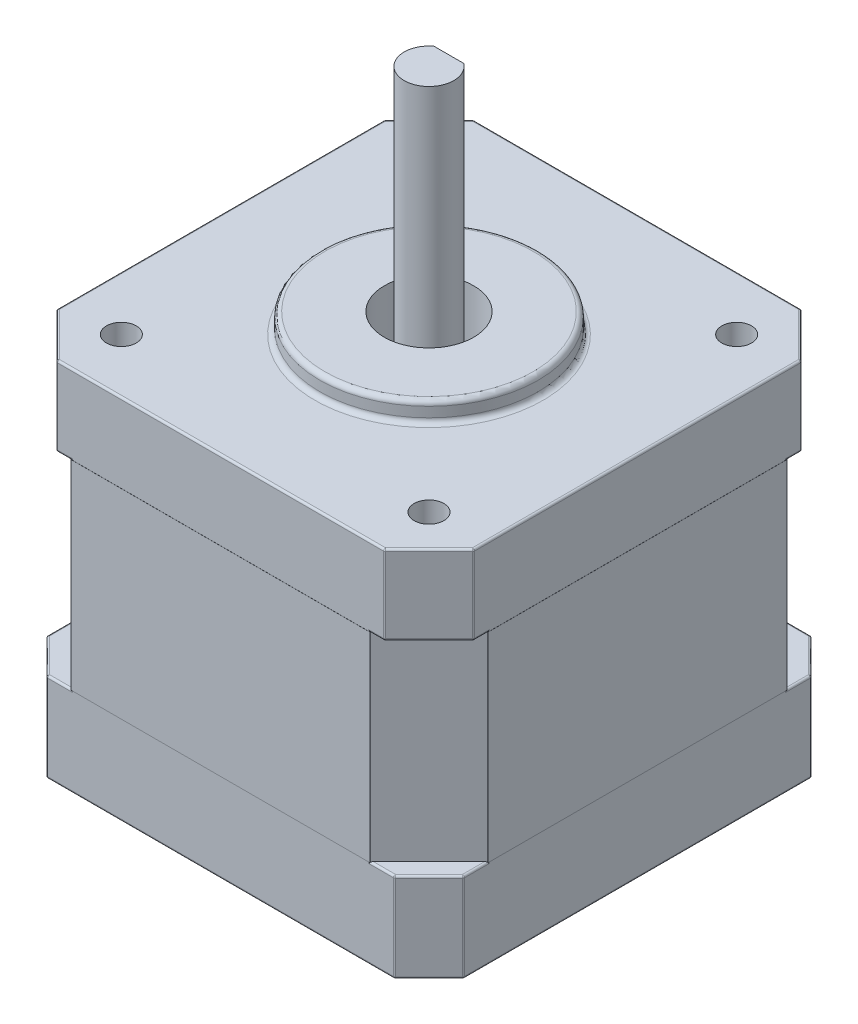
from build123d import *

# Parameters (mm, degrees)
IZIM1_R                          = 4.5
IZIM1_R_2                        = 1.5
Y_KSEKLIK_EKSTR_ZYON1_DEPTH      = 9
IZIM2_W                          = 16
IZIM2_H                          = 4
KES_EKSTR_ZYON1_DEPTH            = 6
IZIM3_W                          = 16
IZIM3_H                          = 5
Y_KSEKLIK_EKSTR_ZYON2_DEPTH      = 0.5
Y_KSEKLIK_EKSTR_ZYON3_DEPTH      = 5
IZIM7_R                          = 4.5
Y_KSEKLIK_EKSTR_ZYON4_DEPTH      = 20
IZIM8_R                          = 4.5
Y_KSEKLIK_EKSTR_ZYON5_DEPTH      = 8
IZIM10_R                         = 11
IZIM10_R_2                       = 4.5
Y_KSEKLIK_EKSTR_ZYON6_DEPTH      = 2
RADYUS1_R                        = 0.5
RADYUS2_R                        = 0.2
Y_KSEKLIK_EKSTR_ZYON7_DEPTH      = 11.5
Y_KSEKLIK_EKSTR_ZYON7_DEPTH_BACK = 11.5
IZIM11_R                         = 4.5
IZIM11_R_2                       = 2.5
Y_KSEKLIK_EKSTR_ZYON8_START      = -55.4
IZIM12_R                         = 2.5
Y_KSEKLIK_EKSTR_ZYON8_DEPTH      = 55.4
IZIM14_R                         = 0.25
Y_KSEKLIK_EKSTR_ZYON9_DEPTH      = 3
IZIM15_W                         = 16
IZIM15_H                         = 0.5
Y_KSEKLIK_EKSTR_ZYON11_DEPTH     = 5.5
IZIM17_W                         = 30.117157288
IZIM17_H                         = 20.117157288
Y_KSEKLIK_EKSTR_ZYON13_DEPTH     = 0.01
IZIM18_W                         = 30.117157288
IZIM18_H                         = 20.117157288
Y_KSEKLIK_EKSTR_ZYON14_DEPTH     = 0.01
IZIM19_W                         = 30.117157288
IZIM19_H                         = 20.117157288
Y_KSEKLIK_EKSTR_ZYON15_DEPTH     = 0.01
IZIM20_W                         = 30.117157288
IZIM20_H                         = 20.117157288
Y_KSEKLIK_EKSTR_ZYON16_DEPTH     = 0.01
CUT_EXTRUDE1_START               = -3
SKETCH2_R                        = 1.5
CUT_EXTRUDE1_DEPTH               = 3
SKETCH3_W                        = 17.937634035
SKETCH3_H                        = 9.816018803
CUT_EXTRUDE2_DEPTH               = 17.8


with BuildPart() as part:
    # Çizim1 → Yükseklik-Ekstrüzyon1 (new body)
    with BuildSketch(Plane(origin=(0, 0, 0), x_dir=(1, 0, 0), z_dir=(0, 1, 0))):
        Polygon((-21, 17.5), (-17.5, 21), (-8, 21), (-8, 25), (8, 25), (8, 21), (17.5, 21), (21, 17.5), (21, -17.5), (17.5, -21), (-17.5, -21), (-21, -17.5), align=None)
        with Locations(Location((0, 0, 0), (0, 0, 270))):
            Circle(IZIM1_R, mode=Mode.SUBTRACT)
        with Locations(Location((15.5, 15.5, 0), (0, 0, 270))):
            Circle(IZIM1_R_2, mode=Mode.SUBTRACT)
        with Locations(Location((15.5, -15.5, 0), (0, 0, 270))):
            Circle(IZIM1_R_2, mode=Mode.SUBTRACT)
        with Locations(Location((-15.5, -15.5, 0), (0, 0, 270))):
            Circle(IZIM1_R_2, mode=Mode.SUBTRACT)
        with Locations(Location((-15.5, 15.5, 0), (0, 0, 270))):
            Circle(IZIM1_R_2, mode=Mode.SUBTRACT)
    extrude(amount=Y_KSEKLIK_EKSTR_ZYON1_DEPTH)

    # Çizim2 → Kes-Ekstrüzyon1 (cut)
    with BuildSketch(Plane(origin=(0, 9, 0), x_dir=(1, 0, 0), z_dir=(0, 1, 0))):
        with Locations((0, 23)):
            Rectangle(IZIM2_W, IZIM2_H)
    extrude(amount=-KES_EKSTR_ZYON1_DEPTH, mode=Mode.SUBTRACT)

    # Çizim3 → Yükseklik-Ekstrüzyon2 (add)
    with BuildSketch(Plane(origin=(0, 0, -21), x_dir=(-1, 0, 0), z_dir=(0, 0, -1))):
        with Locations((0, 6.5)):
            Rectangle(IZIM3_W, IZIM3_H)
    extrude(amount=Y_KSEKLIK_EKSTR_ZYON2_DEPTH)

    # Çizim4 → Yükseklik-Ekstrüzyon3 (add)
    with BuildSketch(Plane(origin=(0, 0, -21.5), x_dir=(-1, 0, 0), z_dir=(0, 0, -1))):
        Polygon((4, 9), (8, 9), (8, 4), (-8, 4), (-8, 9), (-4, 9), (-4, 8.5), (-7.5, 8.5), (-7.5, 4.5), (7.5, 4.5), (7.5, 8.5), (4, 8.5), align=None)
    extrude(amount=Y_KSEKLIK_EKSTR_ZYON3_DEPTH)

    # Çizim7 → Yükseklik-Ekstrüzyon4 (add)
    with BuildSketch(Plane(origin=(0, 9, 0), x_dir=(1, 0, 0), z_dir=(0, 1, 0))):
        Polygon((-15, 21), (15, 21), (21, 15), (21, -15), (15, -21), (-15, -21), (-21, -15), (-21, 15), align=None)
        with Locations(Location((0, 0, 0), (0, 0, 270))):
            Circle(IZIM7_R, mode=Mode.SUBTRACT)
    extrude(amount=Y_KSEKLIK_EKSTR_ZYON4_DEPTH)

    # Çizim8 → Yükseklik-Ekstrüzyon5 (add)
    with BuildSketch(Plane(origin=(0, 29, 0), x_dir=(1, 0, 0), z_dir=(0, 1, 0))):
        Polygon((-16.5, 21), (16.5, 21), (21, 16.5), (21, -16.5), (16.5, -21), (-16.5, -21), (-21, -16.5), (-21, 16.5), align=None)
        with Locations(Location((0, 0, 0), (0, 0, 270))):
            Circle(IZIM8_R, mode=Mode.SUBTRACT)
    extrude(amount=Y_KSEKLIK_EKSTR_ZYON5_DEPTH)

    # Çizim10 → Yükseklik-Ekstrüzyon6 (add)
    with BuildSketch(Plane(origin=(0, 37, 0), x_dir=(1, 0, 0), z_dir=(0, 1, 0))):
        with Locations(Location((0, 0, 0), (0, 0, 90))):
            Circle(IZIM10_R)
        with Locations(Location((0, 0, 0), (0, 0, 270))):
            Circle(IZIM10_R_2, mode=Mode.SUBTRACT)
    extrude(amount=Y_KSEKLIK_EKSTR_ZYON6_DEPTH)

    # Radyus1
    radyus1_edges = [part.edges().sort_by_distance(p)[0] for p in [
        (0, 37, 11),
        (0, 39, 11),
    ]]
    fillet(radyus1_edges, radius=RADYUS1_R)

    # Radyus2
    radyus2_edges = [part.edges().sort_by_distance(p)[0] for p in [
        (-21, 9, -16.25),
        (-8, 0, -23),
        (0, 0, -25),
        (8, 0, -23),
        (-16.25, 9, -21),
        (-21, 9, 16.25),
        (16.25, 9, 21),
        (21, 9, -16.25),
        (12.75, 0, -21),
        (19.25, 0, -19.25),
        (-15, 19, -21),
        (-21, 19, -15),
        (-21, 19, 15),
        (-15, 19, 21),
        (15, 19, 21),
        (21, 19, 15),
        (21, 19, -15),
        (21, 0, 0),
        (15, 19, -21),
        (-19.25, 9, 19.25),
        (19.25, 0, 19.25),
        (0, 0, 21),
        (-19.25, 0, 19.25),
        (-21, 0, 0),
        (-19.25, 0, -19.25),
        (-12.75, 0, -21),
        (-18.75, 37, -18.75),
        (-21, 37, 0),
        (-18.75, 37, 18.75),
        (0, 37, 21),
        (18.75, 37, 18.75),
        (21, 37, 0),
        (18.75, 37, -18.75),
        (0, 37, -21),
        (-18.75, 29, -18.75),
        (-16.5, 33, -21),
        (-21, 29, -15.75),
        (-21, 29, 15.75),
        (-21, 33, -16.5),
        (-18.75, 29, 18.75),
        (-21, 33, 16.5),
        (-15.75, 29, 21),
        (15.75, 29, 21),
        (-16.5, 33, 21),
        (18.75, 29, 18.75),
        (-16.25, 9, 21),
        (16.5, 33, 21),
        (21, 29, 15.75),
        (21, 29, -15.75),
        (21, 33, 16.5),
        (18.75, 29, -18.75),
        (21, 33, -16.5),
        (15.75, 29, -21),
        (-15.75, 29, -21),
        (16.5, 33, -21),
        (19.25, 9, 19.25),
        (17.5, 4.5, -21),
        (21, 4.5, -17.5),
        (21, 4.5, 17.5),
        (17.5, 4.5, 21),
        (-17.5, 4.5, 21),
        (-21, 4.5, 17.5),
        (-21, 4.5, -17.5),
        (-17.5, 4.5, -21),
        (21, 9, 16.25),
        (19.25, 9, -19.25),
        (16.25, 9, -21),
        (-8, 1.5, -21),
        (-8, 1.5, -25),
        (8, 1.5, -25),
        (8, 1.5, -21),
        (8, 3, -23),
        (0, 3, -21),
        (-8, 3, -23),
        (0, 3, -25),
        (-19.25, 9, -19.25),
    ]]
    fillet(radyus2_edges, radius=RADYUS2_R)

    # Çizim11 → Yükseklik-Ekstrüzyon7 (add, two sides: drawn at the far end of the back side and taken through both)
    with BuildSketch(Plane(origin=(0, 16.5, 0), x_dir=(-1, 0, 0), z_dir=(0, -1, 0)).offset(-Y_KSEKLIK_EKSTR_ZYON7_DEPTH_BACK)):
        with Locations(Location((0, 0, 0), (0, 0, 90))):
            Circle(IZIM11_R)
        with Locations(Location((0, 0, 0), (0, 0, 90))):
            Circle(IZIM11_R_2, mode=Mode.SUBTRACT)
    extrude(amount=Y_KSEKLIK_EKSTR_ZYON7_DEPTH + Y_KSEKLIK_EKSTR_ZYON7_DEPTH_BACK)

    # Çizim12 → Yükseklik-Ekstrüzyon8 (add)
    with BuildSketch(Plane.XZ.offset(-5).offset(Y_KSEKLIK_EKSTR_ZYON8_START)):
        with Locations(Location((0, 0, 0), (0, 0, 270))):
            Circle(IZIM12_R)
    extrude(amount=Y_KSEKLIK_EKSTR_ZYON8_DEPTH)

    # Çizim14 → Yükseklik-Ekstrüzyon9 (add)
    with BuildSketch(Plane(origin=(0, 0, -21.5), x_dir=(-1, 0, 0), z_dir=(0, 0, -1))):
        with Locations(Location((-1.25, 7, 0), (0, 0, 180))):
            Circle(IZIM14_R)
        with Locations(Location((-3.75, 7, 0), (0, 0, 180))):
            Circle(IZIM14_R)
        with Locations(Location((-6.25, 7, 0), (0, 0, 180))):
            Circle(IZIM14_R)
        with Locations(Location((1.25, 7, 0), (0, 0, 180))):
            Circle(IZIM14_R)
        with Locations(Location((3.75, 7, 0), (0, 0, 180))):
            Circle(IZIM14_R)
        with Locations(Location((6.25, 7, 0), (0, 0, 180))):
            Circle(IZIM14_R)
    extrude(amount=Y_KSEKLIK_EKSTR_ZYON9_DEPTH)

    # Çizim15 → Yükseklik-Ekstrüzyon11 (add, through all)
    with BuildSketch(Plane(origin=(0, 0, -21), x_dir=(-1, 0, 0), z_dir=(0, 0, -1))):
        with Locations((0, 3.6)):
            Rectangle(IZIM15_W, IZIM15_H)
    extrude(amount=Y_KSEKLIK_EKSTR_ZYON11_DEPTH)

    # Çizim17 → Yükseklik-Ekstrüzyon13 (add)
    with BuildSketch(Plane(origin=(21, 0, 0), x_dir=(0, 0, -1), z_dir=(1, 0, 0))):
        with Locations((0, 19)):
            Rectangle(IZIM17_W, IZIM17_H)
    extrude(amount=Y_KSEKLIK_EKSTR_ZYON13_DEPTH)

    # Çizim18 → Yükseklik-Ekstrüzyon14 (add)
    with BuildSketch(Plane(origin=(0, 0, -21), x_dir=(-1, 0, 0), z_dir=(0, 0, -1))):
        with Locations((0, 19)):
            Rectangle(IZIM18_W, IZIM18_H)
    extrude(amount=Y_KSEKLIK_EKSTR_ZYON14_DEPTH)

    # Çizim19 → Yükseklik-Ekstrüzyon15 (add)
    with BuildSketch(Plane.ZY.offset(21)):
        with Locations((0, 19)):
            Rectangle(IZIM19_W, IZIM19_H)
    extrude(amount=Y_KSEKLIK_EKSTR_ZYON15_DEPTH)

    # Çizim20 → Yükseklik-Ekstrüzyon16 (add)
    with BuildSketch(Plane.XY.offset(21)):
        with Locations((0, 19)):
            Rectangle(IZIM20_W, IZIM20_H)
    extrude(amount=Y_KSEKLIK_EKSTR_ZYON16_DEPTH)

    # Sketch2 → Cut-Extrude1 (cut)
    with BuildSketch(Plane(origin=(0, 37, 0), x_dir=(1, 0, 0), z_dir=(0, 1, 0)).offset(CUT_EXTRUDE1_START)):
        with Locations(Location((15.5, 15.5, 0), (0, 0, 270))):
            Circle(SKETCH2_R)
        with Locations(Location((15.5, -15.5, 0), (0, 0, 270))):
            Circle(SKETCH2_R)
        with Locations(Location((-15.5, -15.5, 0), (0, 0, 270))):
            Circle(SKETCH2_R)
        with Locations(Location((-15.5, 15.5, 0), (0, 0, 270))):
            Circle(SKETCH2_R)
    extrude(amount=CUT_EXTRUDE1_DEPTH, mode=Mode.SUBTRACT)

    # Sketch3 → Cut-Extrude2 (cut)
    with BuildSketch(Plane(origin=(0, 60.4, 0), x_dir=(1, 0, 0), z_dir=(0, 1, 0))):
        with Locations((5.242552763, 6.908009402)):
            Rectangle(SKETCH3_W, SKETCH3_H)
    extrude(amount=-CUT_EXTRUDE2_DEPTH, mode=Mode.SUBTRACT)


solid = part.part
